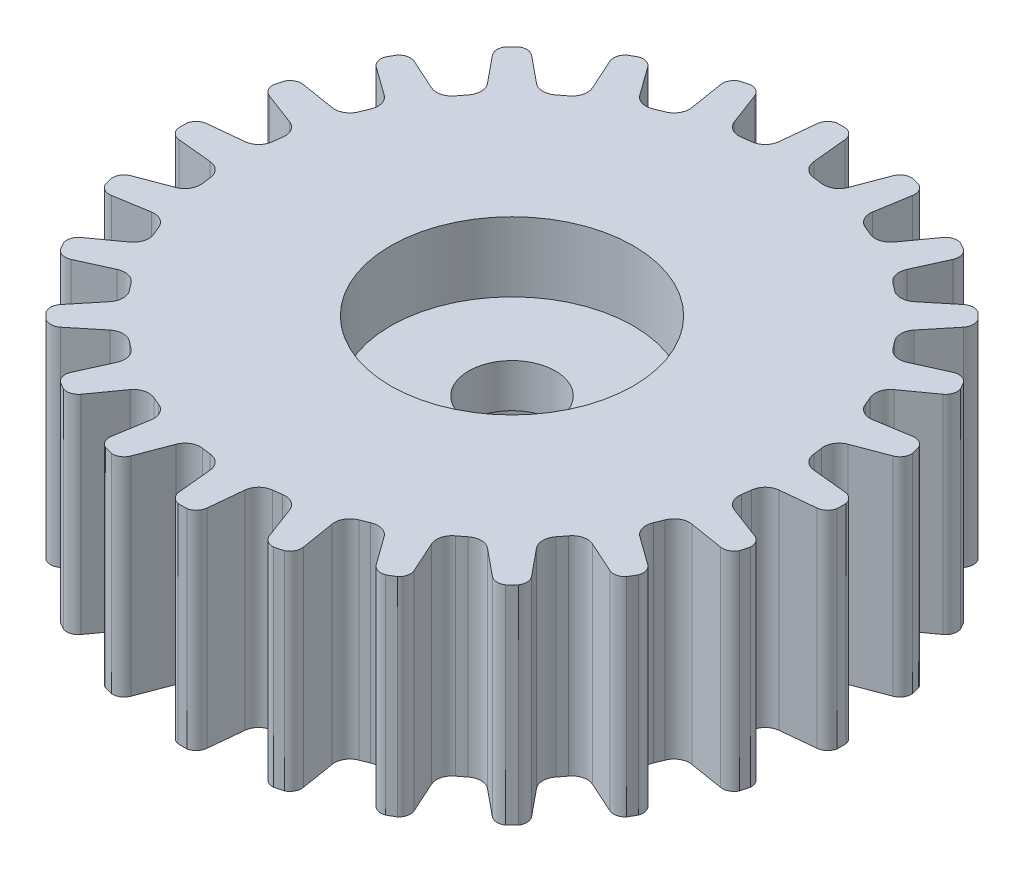
from build123d import *

# Parameters (mm, degrees)
SKETCH1_R           = 9.5
SKETCH1_R_2         = 2.45
BOSS_EXTRUDE1_DEPTH = 6
CUT_EXTRUDE1_START  = -6
SKETCH2_R           = 11.178148921
CUT_EXTRUDE1_DEPTH  = 6
BOSS_EXTRUDE2_START = -3.25
SKETCH3_R           = 2.45
SKETCH3_R_2         = 1.25
BOSS_EXTRUDE2_DEPTH = 3.25
SKETCH4_R           = 3.5
CUT_EXTRUDE2_DEPTH  = 2


with BuildPart() as part:
    # Sketch1 → Boss-Extrude1 (new body)
    with BuildSketch(Plane(origin=(0, 0, 0), x_dir=(1, 0, 0), z_dir=(0, 1, 0))):
        with Locations(Location((0, 0, 0), (0, 0, 270))):
            Circle(SKETCH1_R)
        with Locations(Location((0, 0, 0), (0, 0, 270))):
            Circle(SKETCH1_R_2, mode=Mode.SUBTRACT)
    extrude(amount=BOSS_EXTRUDE1_DEPTH)

    # Sketch2 → Cut-Extrude1 (cut)
    with BuildSketch(Plane(origin=(0, 6, 0), x_dir=(1, 0, 0), z_dir=(0, 1, 0)).offset(CUT_EXTRUDE1_START)):
        Circle(SKETCH2_R)
        with BuildLine():
            Line((0.5, 8.2), (0.4, 9.2))
            ThreePointArc((0.4, 9.2), (0.265875857, 9.437834476), (0, 9.5))
            ThreePointArc((0, 9.5), (-0.265875857, 9.437834476), (-0.4, 9.2))
            Line((-0.4, 9.2), (-0.5, 8.2))
            ThreePointArc((-0.5, 8.2), (-0.628607324, 7.928607324), (-0.9, 7.8))
            ThreePointArc((-0.9, 7.8), (-1.024859212, 7.784578575), (-1.149455308, 7.767158586))
            ThreePointArc((-1.149455308, 7.767158586), (-1.444886527, 7.821142129), (-1.639353257, 8.050001298))
            Line((-1.639353257, 8.050001298), (-1.994764884, 8.99004522))
            ThreePointArc((-1.994764884, 8.99004522), (-2.18587495, 9.1850618), (-2.458780928, 9.17629535))
            ThreePointArc((-2.458780928, 9.17629535), (-2.699507664, 9.047434329), (-2.767505545, 8.782989984))
            Line((-2.767505545, 8.782989984), (-2.605279083, 7.791182253))
            ThreePointArc((-2.605279083, 7.791182253), (-2.659262626, 7.495751034), (-2.888121795, 7.301284304))
            ThreePointArc((-2.888121795, 7.301284304), (-3.004735175, 7.25407241), (-3.120577137, 7.20499815))
            ThreePointArc((-3.120577137, 7.20499815), (-3.41991375, 7.180679022), (-3.666987298, 7.351408311))
            Line((-3.666987298, 7.351408311), (-4.253589838, 8.167433715))
            ThreePointArc((-4.253589838, 8.167433715), (-4.488661992, 8.306342342), (-4.75, 8.227241336))
            ThreePointArc((-4.75, 8.227241336), (-4.949172485, 8.040466485), (-4.946410162, 7.767433715))
            Line((-4.946410162, 7.767433715), (-4.533012702, 6.851408311))
            ThreePointArc((-4.533012702, 6.851408311), (-4.508693574, 6.552071697), (-4.679422863, 6.30499815))
            ThreePointArc((-4.679422863, 6.30499815), (-4.779843401, 6.229213198), (-4.87903679, 6.151828996))
            ThreePointArc((-4.87903679, 6.151828996), (-5.161879503, 6.050864506), (-5.444722215, 6.151828996))
            Line((-5.444722215, 6.151828996), (-6.222539674, 6.788225099))
            ThreePointArc((-6.222539674, 6.788225099), (-6.485554136, 6.861559379), (-6.717514421, 6.717514421))
            ThreePointArc((-6.717514421, 6.717514421), (-6.861559379, 6.485554136), (-6.788225099, 6.222539674))
            Line((-6.788225099, 6.222539674), (-6.151828996, 5.444722215))
            ThreePointArc((-6.151828996, 5.444722215), (-6.050864506, 5.161879503), (-6.151828996, 4.87903679))
            ThreePointArc((-6.151828996, 4.87903679), (-6.229213198, 4.779843401), (-6.30499815, 4.679422863))
            ThreePointArc((-6.30499815, 4.679422863), (-6.552071697, 4.508693574), (-6.851408311, 4.533012702))
            Line((-6.851408311, 4.533012702), (-7.767433715, 4.946410162))
            ThreePointArc((-7.767433715, 4.946410162), (-8.040466485, 4.949172485), (-8.227241336, 4.75))
            ThreePointArc((-8.227241336, 4.75), (-8.306342342, 4.488661992), (-8.167433715, 4.253589838))
            Line((-8.167433715, 4.253589838), (-7.351408311, 3.666987298))
            ThreePointArc((-7.351408311, 3.666987298), (-7.180679022, 3.41991375), (-7.20499815, 3.120577137))
            ThreePointArc((-7.20499815, 3.120577137), (-7.25407241, 3.004735175), (-7.301284304, 2.888121795))
            ThreePointArc((-7.301284304, 2.888121795), (-7.495751034, 2.659262626), (-7.791182253, 2.605279083))
            Line((-7.791182253, 2.605279083), (-8.782989984, 2.767505545))
            ThreePointArc((-8.782989984, 2.767505545), (-9.047434329, 2.699507664), (-9.17629535, 2.458780928))
            ThreePointArc((-9.17629535, 2.458780928), (-9.1850618, 2.18587495), (-8.99004522, 1.994764884))
            Line((-8.99004522, 1.994764884), (-8.050001298, 1.639353257))
            ThreePointArc((-8.050001298, 1.639353257), (-7.821142129, 1.444886527), (-7.767158586, 1.149455308))
            ThreePointArc((-7.767158586, 1.149455308), (-7.784578575, 1.024859212), (-7.8, 0.9))
            ThreePointArc((-7.8, 0.9), (-7.928607324, 0.628607324), (-8.2, 0.5))
            Line((-8.2, 0.5), (-9.2, 0.4))
            ThreePointArc((-9.2, 0.4), (-9.437834476, 0.265875857), (-9.5, 0))
            ThreePointArc((-9.5, 0), (-9.437834476, -0.265875857), (-9.2, -0.4))
            Line((-9.2, -0.4), (-8.2, -0.5))
            ThreePointArc((-8.2, -0.5), (-7.928607324, -0.628607324), (-7.8, -0.9))
            ThreePointArc((-7.8, -0.9), (-7.784578575, -1.024859212), (-7.767158586, -1.149455308))
            ThreePointArc((-7.767158586, -1.149455308), (-7.821142129, -1.444886527), (-8.050001298, -1.639353257))
            Line((-8.050001298, -1.639353257), (-8.99004522, -1.994764884))
            ThreePointArc((-8.99004522, -1.994764884), (-9.1850618, -2.18587495), (-9.17629535, -2.458780928))
            ThreePointArc((-9.17629535, -2.458780928), (-9.047434329, -2.699507664), (-8.782989984, -2.767505545))
            Line((-8.782989984, -2.767505545), (-7.791182253, -2.605279083))
            ThreePointArc((-7.791182253, -2.605279083), (-7.495751034, -2.659262626), (-7.301284304, -2.888121795))
            ThreePointArc((-7.301284304, -2.888121795), (-7.25407241, -3.004735175), (-7.20499815, -3.120577137))
            ThreePointArc((-7.20499815, -3.120577137), (-7.180679022, -3.41991375), (-7.351408311, -3.666987298))
            Line((-7.351408311, -3.666987298), (-8.167433715, -4.253589838))
            ThreePointArc((-8.167433715, -4.253589838), (-8.306342342, -4.488661992), (-8.227241336, -4.75))
            ThreePointArc((-8.227241336, -4.75), (-8.040466485, -4.949172485), (-7.767433715, -4.946410162))
            Line((-7.767433715, -4.946410162), (-6.851408311, -4.533012702))
            ThreePointArc((-6.851408311, -4.533012702), (-6.552071697, -4.508693574), (-6.30499815, -4.679422863))
            ThreePointArc((-6.30499815, -4.679422863), (-6.229213198, -4.779843401), (-6.151828996, -4.87903679))
            ThreePointArc((-6.151828996, -4.87903679), (-6.050864506, -5.161879503), (-6.151828996, -5.444722215))
            Line((-6.151828996, -5.444722215), (-6.788225099, -6.222539674))
            ThreePointArc((-6.788225099, -6.222539674), (-6.861559379, -6.485554136), (-6.717514421, -6.717514421))
            ThreePointArc((-6.717514421, -6.717514421), (-6.485554136, -6.861559379), (-6.222539674, -6.788225099))
            Line((-6.222539674, -6.788225099), (-5.444722215, -6.151828996))
            ThreePointArc((-5.444722215, -6.151828996), (-5.161879503, -6.050864506), (-4.87903679, -6.151828996))
            ThreePointArc((-4.87903679, -6.151828996), (-4.779843401, -6.229213198), (-4.679422863, -6.30499815))
            ThreePointArc((-4.679422863, -6.30499815), (-4.508693574, -6.552071697), (-4.533012702, -6.851408311))
            Line((-4.533012702, -6.851408311), (-4.946410162, -7.767433715))
            ThreePointArc((-4.946410162, -7.767433715), (-4.949172485, -8.040466485), (-4.75, -8.227241336))
            ThreePointArc((-4.75, -8.227241336), (-4.488661992, -8.306342342), (-4.253589838, -8.167433715))
            Line((-4.253589838, -8.167433715), (-3.666987298, -7.351408311))
            ThreePointArc((-3.666987298, -7.351408311), (-3.41991375, -7.180679022), (-3.120577137, -7.20499815))
            ThreePointArc((-3.120577137, -7.20499815), (-3.004735175, -7.25407241), (-2.888121795, -7.301284304))
            ThreePointArc((-2.888121795, -7.301284304), (-2.659262626, -7.495751034), (-2.605279083, -7.791182253))
            Line((-2.605279083, -7.791182253), (-2.767505545, -8.782989984))
            ThreePointArc((-2.767505545, -8.782989984), (-2.699507664, -9.047434329), (-2.458780928, -9.17629535))
            ThreePointArc((-2.458780928, -9.17629535), (-2.18587495, -9.1850618), (-1.994764884, -8.99004522))
            Line((-1.994764884, -8.99004522), (-1.639353257, -8.050001298))
            ThreePointArc((-1.639353257, -8.050001298), (-1.444886527, -7.821142129), (-1.149455308, -7.767158586))
            ThreePointArc((-1.149455308, -7.767158586), (-1.024859212, -7.784578575), (-0.9, -7.8))
            ThreePointArc((-0.9, -7.8), (-0.628607324, -7.928607324), (-0.5, -8.2))
            Line((-0.5, -8.2), (-0.4, -9.2))
            ThreePointArc((-0.4, -9.2), (-0.265875857, -9.437834476), (0, -9.5))
            ThreePointArc((0, -9.5), (0.265875857, -9.437834476), (0.4, -9.2))
            Line((0.4, -9.2), (0.5, -8.2))
            ThreePointArc((0.5, -8.2), (0.628607324, -7.928607324), (0.9, -7.8))
            ThreePointArc((0.9, -7.8), (1.024859212, -7.784578575), (1.149455308, -7.767158586))
            ThreePointArc((1.149455308, -7.767158586), (1.444886527, -7.821142129), (1.639353257, -8.050001298))
            Line((1.639353257, -8.050001298), (1.994764884, -8.99004522))
            ThreePointArc((1.994764884, -8.99004522), (2.18587495, -9.1850618), (2.458780928, -9.17629535))
            ThreePointArc((2.458780928, -9.17629535), (2.699507664, -9.047434329), (2.767505545, -8.782989984))
            Line((2.767505545, -8.782989984), (2.605279083, -7.791182253))
            ThreePointArc((2.605279083, -7.791182253), (2.659262626, -7.495751034), (2.888121795, -7.301284304))
            ThreePointArc((2.888121795, -7.301284304), (3.004735175, -7.25407241), (3.120577137, -7.20499815))
            ThreePointArc((3.120577137, -7.20499815), (3.41991375, -7.180679022), (3.666987298, -7.351408311))
            Line((3.666987298, -7.351408311), (4.253589838, -8.167433715))
            ThreePointArc((4.253589838, -8.167433715), (4.488661992, -8.306342342), (4.75, -8.227241336))
            ThreePointArc((4.75, -8.227241336), (4.949172485, -8.040466485), (4.946410162, -7.767433715))
            Line((4.946410162, -7.767433715), (4.533012702, -6.851408311))
            ThreePointArc((4.533012702, -6.851408311), (4.508693574, -6.552071697), (4.679422863, -6.30499815))
            ThreePointArc((4.679422863, -6.30499815), (4.779843401, -6.229213198), (4.87903679, -6.151828996))
            ThreePointArc((4.87903679, -6.151828996), (5.161879503, -6.050864506), (5.444722215, -6.151828996))
            Line((5.444722215, -6.151828996), (6.222539674, -6.788225099))
            ThreePointArc((6.222539674, -6.788225099), (6.485554136, -6.861559379), (6.717514421, -6.717514421))
            ThreePointArc((6.717514421, -6.717514421), (6.861559379, -6.485554136), (6.788225099, -6.222539674))
            Line((6.788225099, -6.222539674), (6.151828996, -5.444722215))
            ThreePointArc((6.151828996, -5.444722215), (6.050864506, -5.161879503), (6.151828996, -4.87903679))
            ThreePointArc((6.151828996, -4.87903679), (6.229213198, -4.779843401), (6.30499815, -4.679422863))
            ThreePointArc((6.30499815, -4.679422863), (6.552071697, -4.508693574), (6.851408311, -4.533012702))
            Line((6.851408311, -4.533012702), (7.767433715, -4.946410162))
            ThreePointArc((7.767433715, -4.946410162), (8.040466485, -4.949172485), (8.227241336, -4.75))
            ThreePointArc((8.227241336, -4.75), (8.306342342, -4.488661992), (8.167433715, -4.253589838))
            Line((8.167433715, -4.253589838), (7.351408311, -3.666987298))
            ThreePointArc((7.351408311, -3.666987298), (7.180679022, -3.41991375), (7.20499815, -3.120577137))
            ThreePointArc((7.20499815, -3.120577137), (7.25407241, -3.004735175), (7.301284304, -2.888121795))
            ThreePointArc((7.301284304, -2.888121795), (7.495751034, -2.659262626), (7.791182253, -2.605279083))
            Line((7.791182253, -2.605279083), (8.782989984, -2.767505545))
            ThreePointArc((8.782989984, -2.767505545), (9.047434329, -2.699507664), (9.17629535, -2.458780928))
            ThreePointArc((9.17629535, -2.458780928), (9.1850618, -2.18587495), (8.99004522, -1.994764884))
            Line((8.99004522, -1.994764884), (8.050001298, -1.639353257))
            ThreePointArc((8.050001298, -1.639353257), (7.821142129, -1.444886527), (7.767158586, -1.149455308))
            ThreePointArc((7.767158586, -1.149455308), (7.784578575, -1.024859212), (7.8, -0.9))
            ThreePointArc((7.8, -0.9), (7.928607324, -0.628607324), (8.2, -0.5))
            Line((8.2, -0.5), (9.2, -0.4))
            ThreePointArc((9.2, -0.4), (9.437834476, -0.265875857), (9.5, 0))
            ThreePointArc((9.5, 0), (9.437834476, 0.265875857), (9.2, 0.4))
            Line((9.2, 0.4), (8.2, 0.5))
            ThreePointArc((8.2, 0.5), (7.928607324, 0.628607324), (7.8, 0.9))
            ThreePointArc((7.8, 0.9), (7.784578575, 1.024859212), (7.767158586, 1.149455308))
            ThreePointArc((7.767158586, 1.149455308), (7.821142129, 1.444886527), (8.050001298, 1.639353257))
            Line((8.050001298, 1.639353257), (8.99004522, 1.994764884))
            ThreePointArc((8.99004522, 1.994764884), (9.1850618, 2.18587495), (9.17629535, 2.458780928))
            ThreePointArc((9.17629535, 2.458780928), (9.047434329, 2.699507664), (8.782989984, 2.767505545))
            Line((8.782989984, 2.767505545), (7.791182253, 2.605279083))
            ThreePointArc((7.791182253, 2.605279083), (7.495751034, 2.659262626), (7.301284304, 2.888121795))
            ThreePointArc((7.301284304, 2.888121795), (7.25407241, 3.004735175), (7.20499815, 3.120577137))
            ThreePointArc((7.20499815, 3.120577137), (7.180679022, 3.41991375), (7.351408311, 3.666987298))
            Line((7.351408311, 3.666987298), (8.167433715, 4.253589838))
            ThreePointArc((8.167433715, 4.253589838), (8.306342342, 4.488661992), (8.227241336, 4.75))
            ThreePointArc((8.227241336, 4.75), (8.040466485, 4.949172485), (7.767433715, 4.946410162))
            Line((7.767433715, 4.946410162), (6.851408311, 4.533012702))
            ThreePointArc((6.851408311, 4.533012702), (6.552071697, 4.508693574), (6.30499815, 4.679422863))
            ThreePointArc((6.30499815, 4.679422863), (6.229213198, 4.779843401), (6.151828996, 4.87903679))
            ThreePointArc((6.151828996, 4.87903679), (6.050864506, 5.161879503), (6.151828996, 5.444722215))
            Line((6.151828996, 5.444722215), (6.788225099, 6.222539674))
            ThreePointArc((6.788225099, 6.222539674), (6.861559379, 6.485554136), (6.717514421, 6.717514421))
            ThreePointArc((6.717514421, 6.717514421), (6.485554136, 6.861559379), (6.222539674, 6.788225099))
            Line((6.222539674, 6.788225099), (5.444722215, 6.151828996))
            ThreePointArc((5.444722215, 6.151828996), (5.161879503, 6.050864506), (4.87903679, 6.151828996))
            ThreePointArc((4.87903679, 6.151828996), (4.779843401, 6.229213198), (4.679422863, 6.30499815))
            ThreePointArc((4.679422863, 6.30499815), (4.508693574, 6.552071697), (4.533012702, 6.851408311))
            Line((4.533012702, 6.851408311), (4.946410162, 7.767433715))
            ThreePointArc((4.946410162, 7.767433715), (4.949172485, 8.040466485), (4.75, 8.227241336))
            ThreePointArc((4.75, 8.227241336), (4.488661992, 8.306342342), (4.253589838, 8.167433715))
            Line((4.253589838, 8.167433715), (3.666987298, 7.351408311))
            ThreePointArc((3.666987298, 7.351408311), (3.41991375, 7.180679022), (3.120577137, 7.20499815))
            ThreePointArc((3.120577137, 7.20499815), (3.004735175, 7.25407241), (2.888121795, 7.301284304))
            ThreePointArc((2.888121795, 7.301284304), (2.659262626, 7.495751034), (2.605279083, 7.791182253))
            Line((2.605279083, 7.791182253), (2.767505545, 8.782989984))
            ThreePointArc((2.767505545, 8.782989984), (2.699507664, 9.047434329), (2.458780928, 9.17629535))
            ThreePointArc((2.458780928, 9.17629535), (2.18587495, 9.1850618), (1.994764884, 8.99004522))
            Line((1.994764884, 8.99004522), (1.639353257, 8.050001298))
            ThreePointArc((1.639353257, 8.050001298), (1.444886527, 7.821142129), (1.149455308, 7.767158586))
            ThreePointArc((1.149455308, 7.767158586), (1.024859212, 7.784578575), (0.9, 7.8))
            ThreePointArc((0.9, 7.8), (0.628607324, 7.928607324), (0.5, 8.2))
        make_face(mode=Mode.SUBTRACT)
    extrude(amount=CUT_EXTRUDE1_DEPTH, mode=Mode.SUBTRACT)

    # Sketch3 → Boss-Extrude2 (add)
    with BuildSketch(Plane(origin=(0, 6, 0), x_dir=(1, 0, 0), z_dir=(0, 1, 0)).offset(BOSS_EXTRUDE2_START)):
        with Locations(Location((0, 0, 0), (0, 0, 270))):
            Circle(SKETCH3_R)
        with Locations(Location((0, 0, 0), (0, 0, 270))):
            Circle(SKETCH3_R_2, mode=Mode.SUBTRACT)
    extrude(amount=BOSS_EXTRUDE2_DEPTH)

    # Sketch4 → Cut-Extrude2 (cut)
    with BuildSketch(Plane(origin=(0, 6, 0), x_dir=(1, 0, 0), z_dir=(0, 1, 0))):
        with Locations(Location((0, 0, 0), (0, 0, 270))):
            Circle(SKETCH4_R)
    extrude(amount=-CUT_EXTRUDE2_DEPTH, mode=Mode.SUBTRACT)


solid = part.part
